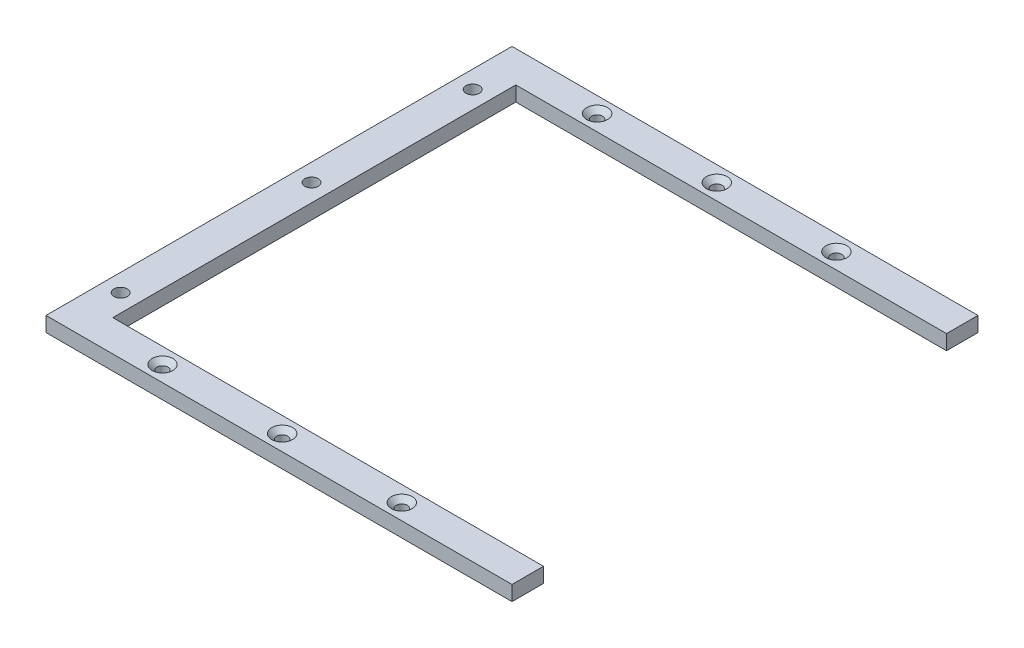
from build123d import *

# Parameters (mm, degrees)
SKETCH2_W           = 7.119984
SKETCH2_H           = 81.28
SKETCH2_R           = 1.35
SKETCH2_W_2         = 93.98
SKETCH2_H_2         = 6.35
SKETCH2_R_2         = 1.1
BOSS_EXTRUDE1_DEPTH = 3
CHAMFER1_SIZE       = 1


with BuildPart() as part:
    # Sketch2 → Boss-Extrude1 (new body)
    # profile 1 of 3: a face of its own
    with BuildSketch(Plane(origin=(0, 0, 0), x_dir=(1, 0, 0), z_dir=(0, 1, 0))):
        with Locations((3.559992, -46.99)):
            Rectangle(SKETCH2_W, SKETCH2_H)
        with Locations(Location((3.559992, -82.490012, 0), (0, 0, 270))):
            Circle(SKETCH2_R, mode=Mode.SUBTRACT)
        with Locations(Location((3.559992, -43.990012, 0), (0, 0, 270))):
            Circle(SKETCH2_R, mode=Mode.SUBTRACT)
        with Locations(Location((3.559992, -11.490012, 0), (0, 0, 270))):
            Circle(SKETCH2_R, mode=Mode.SUBTRACT)
    # profile 2 of 3: a face of its own
    with BuildSketch(Plane(origin=(0, 0, 0), x_dir=(1, 0, 0), z_dir=(0, 1, 0))):
        with Locations((46.99, -3.175)):
            Rectangle(SKETCH2_W_2, SKETCH2_H_2)
        with Locations(Location((68.58, -3.155, 0), (0, 0, 270))):
            Circle(SKETCH2_R_2, mode=Mode.SUBTRACT)
        with Locations(Location((44.45, -3.155, 0), (0, 0, 270))):
            Circle(SKETCH2_R_2, mode=Mode.SUBTRACT)
        with Locations(Location((20.32, -3.155, 0), (0, 0, 270))):
            Circle(SKETCH2_R_2, mode=Mode.SUBTRACT)
    # profile 3 of 3: a face of its own
    with BuildSketch(Plane(origin=(0, 0, 0), x_dir=(1, 0, 0), z_dir=(0, 1, 0))):
        with Locations((46.99, -90.805)):
            Rectangle(SKETCH2_W_2, SKETCH2_H_2)
        with Locations(Location((68.58, -90.805, 0), (0, 0, 270))):
            Circle(SKETCH2_R_2, mode=Mode.SUBTRACT)
        with Locations(Location((44.45, -90.805, 0), (0, 0, 270))):
            Circle(SKETCH2_R_2, mode=Mode.SUBTRACT)
        with Locations(Location((20.32, -90.805, 0), (0, 0, 270))):
            Circle(SKETCH2_R_2, mode=Mode.SUBTRACT)
    extrude(amount=BOSS_EXTRUDE1_DEPTH)

    # Chamfer1
    chamfer1_edges = [part.edges().sort_by_distance(p)[0] for p in [
        (20.32, 3, 89.705),
        (68.58, 3, 2.055),
        (44.45, 3, 2.055),
        (20.32, 3, 2.055),
        (68.58, 3, 89.705),
        (44.45, 3, 89.705),
    ]]
    chamfer(chamfer1_edges, length=CHAMFER1_SIZE)


solid = part.part
